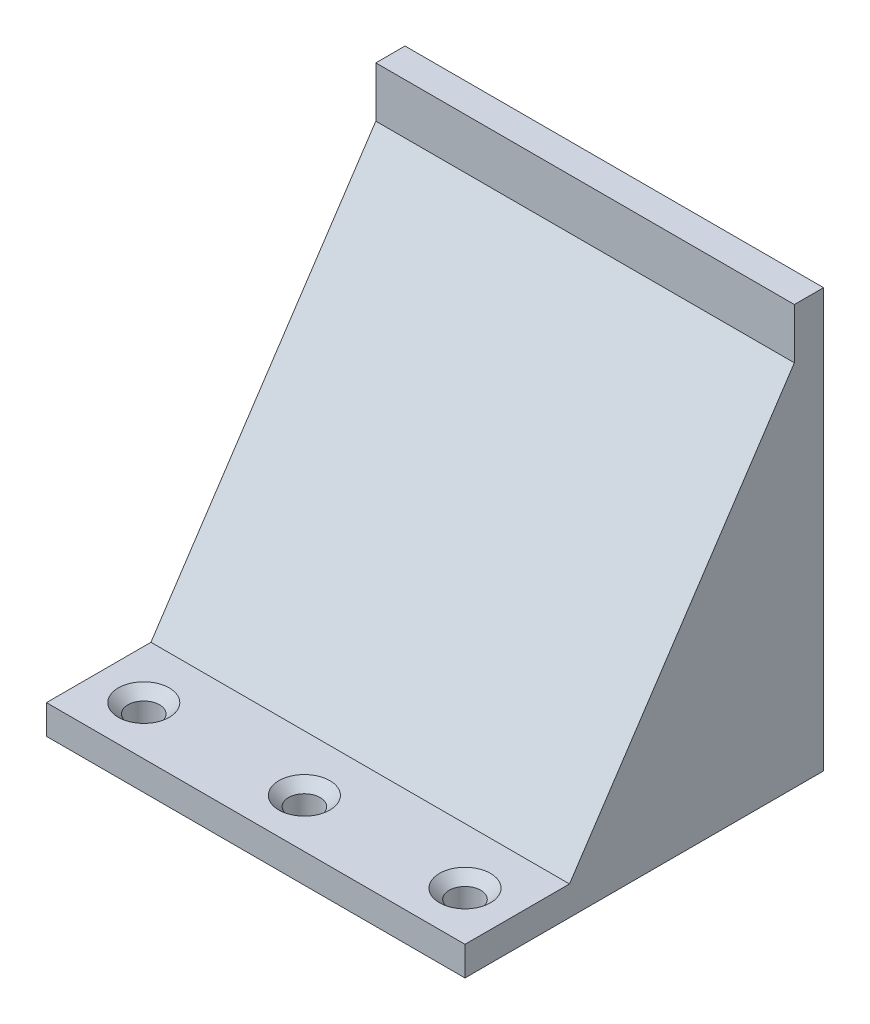
from build123d import *

# Parameters (mm, degrees)
SCHIZZO1_W                   = 43
SCHIZZO1_H                   = 43
ESTRUSIONE_ESTRUSIONE1_DEPTH = 3
ESTRUSIONE_ESTRUSIONE2_DEPTH = 43
SCHIZZO3_R                   = 1.62
TAGLIO_ESTRUSIONE1_DEPTH     = 43
SMUSSO1_SIZE                 = 1
SCHIZZO3_3_R                 = 1.62
TAGLIO_ESTRUSIONE2_DEPTH     = 43
SCHIZZO3_4_R                 = 1.62
TAGLIO_ESTRUSIONE3_DEPTH     = 43
SMUSSO2_SIZE                 = 1
SMUSSO3_SIZE                 = 1


with BuildPart() as part:
    # Schizzo1 → Estrusione-Estrusione1 (new body)
    with BuildSketch(Plane.XY):
        Rectangle(SCHIZZO1_W, SCHIZZO1_H)
    extrude(amount=ESTRUSIONE_ESTRUSIONE1_DEPTH)

    # Schizzo2 → Estrusione-Estrusione2 (add)
    with BuildSketch(Plane.ZY.offset(21.5)):
        Polygon((26.100411225, -18.5), (3, 16.313408291), (3, -21.5), (36.837031378, -21.5), (36.837031378, -18.5), align=None)
    extrude(amount=-ESTRUSIONE_ESTRUSIONE2_DEPTH)

    # Schizzo3 → Taglio-Estrusione1 (cut)
    with BuildSketch(Plane(origin=(0, -18.5, 0), x_dir=(1, 0, 0), z_dir=(0, 1, 0))):
        with Locations((16.5, -31.837031378)):
            Circle(SCHIZZO3_R)
    extrude(amount=-TAGLIO_ESTRUSIONE1_DEPTH, mode=Mode.SUBTRACT)

    # Smusso1
    smusso1_edges = [part.edges().sort_by_distance(p)[0] for p in [
        (14.88, -18.5, 31.837031378),
    ]]
    chamfer(smusso1_edges, length=SMUSSO1_SIZE)

    # Schizzo3<3> → Taglio-Estrusione2 (cut)
    with BuildSketch(Plane(origin=(0, -18.5, 0), x_dir=(1, 0, 0), z_dir=(0, 1, 0))):
        with Locations((0, -31.837031378)):
            Circle(SCHIZZO3_3_R)
    extrude(amount=-TAGLIO_ESTRUSIONE2_DEPTH, mode=Mode.SUBTRACT)

    # Schizzo3<4> → Taglio-Estrusione3 (cut)
    with BuildSketch(Plane(origin=(0, -18.5, 0), x_dir=(1, 0, 0), z_dir=(0, 1, 0))):
        with Locations((-16.5, -31.837031378)):
            Circle(SCHIZZO3_4_R)
    extrude(amount=-TAGLIO_ESTRUSIONE3_DEPTH, mode=Mode.SUBTRACT)

    # Smusso2
    smusso2_edges = [part.edges().sort_by_distance(p)[0] for p in [
        (-1.62, -18.5, 31.837031378),
    ]]
    chamfer(smusso2_edges, length=SMUSSO2_SIZE)

    # Smusso3
    smusso3_edges = [part.edges().sort_by_distance(p)[0] for p in [
        (-18.12, -18.5, 31.837031378),
    ]]
    chamfer(smusso3_edges, length=SMUSSO3_SIZE)


solid = part.part
